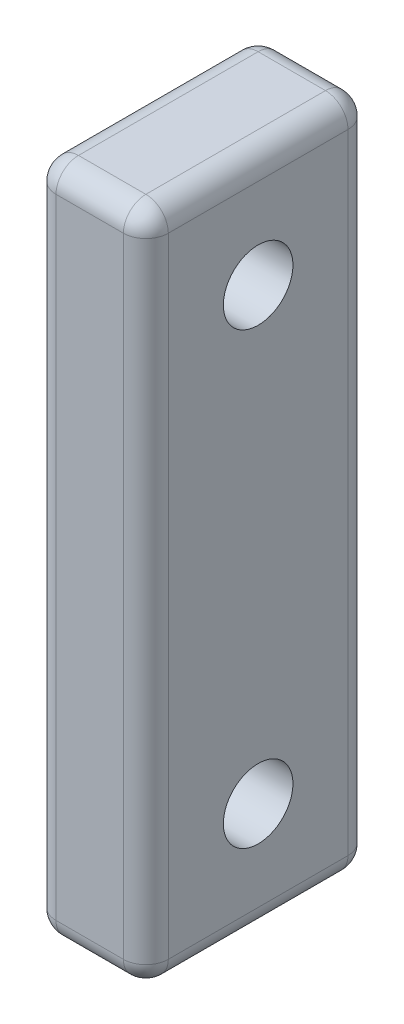
from build123d import *

# Parameters (mm, degrees)
SKETCH1_W                  = 12.7
SKETCH1_H                  = 76.2
BOSS_EXTRUDE1_DEPTH        = 25.4
F_97_0_31_DIAMETER_HOLE1_D = 7.874
FILLET1_R                  = 2.54


with BuildPart() as part:
    # Sketch1 → Boss-Extrude1 (new body)
    with BuildSketch(Plane.XY):
        Rectangle(SKETCH1_W, SKETCH1_H)
    extrude(amount=BOSS_EXTRUDE1_DEPTH)

    # #97 (0.31) Diameter Hole1 (through all)
    with Locations(Plane(origin=(6.35, 0, 0), x_dir=(0, 0, -1), z_dir=(1, 0, 0))):
        with Locations((-12.7, 25.4), (-12.7, -25.4)):
            Hole(F_97_0_31_DIAMETER_HOLE1_D / 2)

    # Fillet1
    fillet1_edges = [part.edges().sort_by_distance(p)[0] for p in [
        (-6.35, 0, 25.4),
        (0, -38.1, 25.4),
        (6.35, 0, 25.4),
        (0, -38.1, 0),
        (-6.35, 0, 0),
        (0, 38.1, 0),
        (6.35, 0, 0),
        (6.35, -38.1, 12.7),
        (-6.35, -38.1, 12.7),
        (-6.35, 38.1, 12.7),
        (6.35, 38.1, 12.7),
        (0, 38.1, 25.4),
    ]]
    fillet(fillet1_edges, radius=FILLET1_R)


solid = part.part
